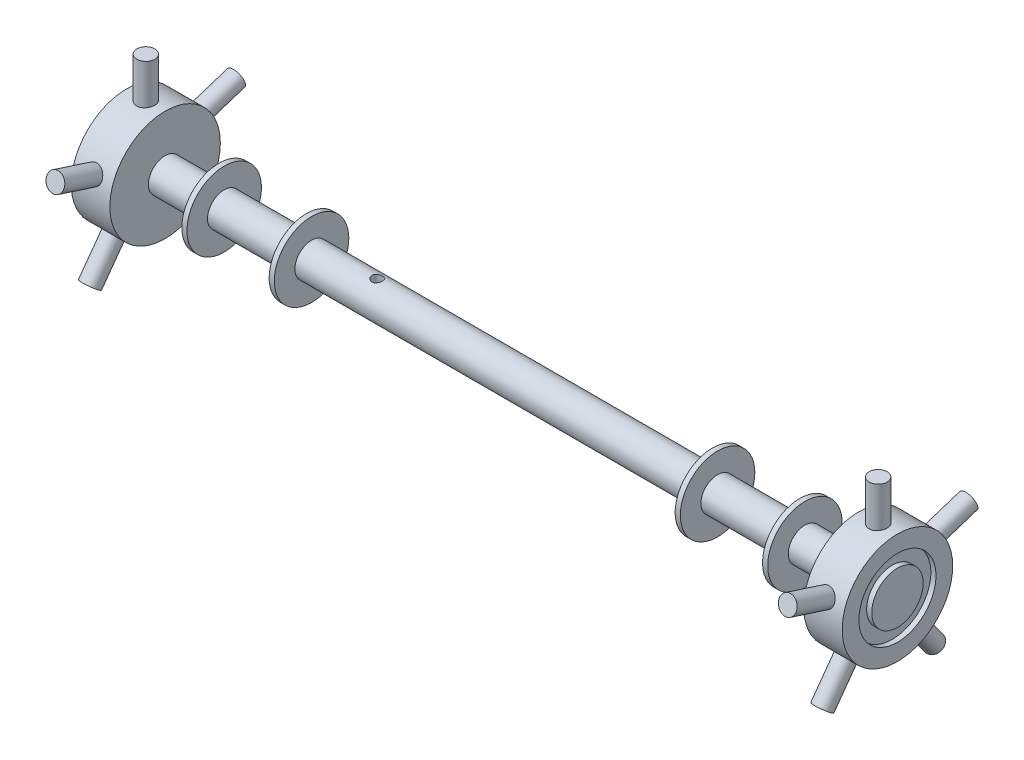
from build123d import *

# Parameters (mm, degrees)
SKETCH2_R               = 8.255
BOSS_EXTRUDE1_DEPTH     = 190.5
SKETCH3_W               = 19.05
SKETCH3_H               = 19.05
SKETCH3_W_2             = 2.54
SKETCH3_H_2             = 10.16
SKETCH6_R               = 19.05
SKETCH6_R_2             = 12.7
CUT_EXTRUDE1_DEPTH      = 2.54
SKETCH5_R               = 4.445
BOSS_EXTRUDE3_DEPTH     = 25.4
CIRPATTERN2_COUNT       = 5
MIRROR3_COPY_1_SKETCH_R = 4.445
MIRROR3_COPY_1_DEPTH    = 25.4
MIRROR3_COPY_2_SKETCH_R = 4.445
MIRROR3_COPY_2_DEPTH    = 25.4
MIRROR3_COPY_3_SKETCH_R = 4.445
MIRROR3_COPY_3_DEPTH    = 25.4
MIRROR3_COPY_4_SKETCH_R = 4.445
MIRROR3_COPY_4_DEPTH    = 25.4
SKETCH7_R               = 2.54
CUT_EXTRUDE2_DEPTH      = 206.628908418


with BuildPart() as part:
    # Sketch2 → Boss-Extrude1 (new, symmetric)
    with BuildSketch(Plane(origin=(0, 0, 0), x_dir=(0, 0, -1), z_dir=(1, 0, 0))):
        Circle(SKETCH2_R)
    extrude(amount=BOSS_EXTRUDE1_DEPTH, both=True)

    # Sketch3 → Revolve1 (revolve)
    with BuildSketch(Plane.XY, mode=Mode.PRIVATE) as revolve1_sk:
        with Locations((180.975, 17.78)):
            Rectangle(SKETCH3_W, SKETCH3_H)
        with Locations((100.33, 13.335)):
            Rectangle(SKETCH3_W_2, SKETCH3_H_2)
        with Locations((143.51, 13.335)):
            Rectangle(SKETCH3_W_2, SKETCH3_H_2)
        with Locations((-100.33, 13.335)):
            Rectangle(SKETCH3_W_2, SKETCH3_H_2)
        with Locations((-143.51, 13.335)):
            Rectangle(SKETCH3_W_2, SKETCH3_H_2)
        with Locations((-180.975, 17.78)):
            Rectangle(SKETCH3_W, SKETCH3_H)
    revolve(revolve1_sk.sketch.rotate(Axis((190.5, 0, 0), (-1, 0, 0)), 90), axis=Axis((190.5, 0, 0), (-1, 0, 0)))

    # Sketch6 → Cut-Extrude1 (cut)
    with BuildSketch(Plane.ZY.offset(190.5)):
        Circle(SKETCH6_R)
        Circle(SKETCH6_R_2, mode=Mode.SUBTRACT)
    cut_extrude1 = extrude(amount=-CUT_EXTRUDE1_DEPTH, mode=Mode.SUBTRACT)

    # Mirror2: Cut-Extrude1 across plane
    add(cut_extrude1.mirror(Plane(origin=(0, 0, 0), x_dir=(0, 0, 1), z_dir=(1, 0, 0))), mode=Mode.SUBTRACT)

    # Sketch5 → Boss-Extrude3 (add)
    with BuildSketch(Plane(origin=(0, 21.59, 0), x_dir=(1, 0, 0), z_dir=(0, 1, 0))):
        with Locations(Location((-180.975, 0, 0), (0, 0, 90))):
            Circle(SKETCH5_R)
    boss_extrude3 = extrude(amount=BOSS_EXTRUDE3_DEPTH)

    # CirPattern2: Boss-Extrude3 ×5 about axis
    cirpattern2_axis = Axis((0, 0, 0), (1, 0, 0))
    for i in range(1, CIRPATTERN2_COUNT):
        add(boss_extrude3.rotate(cirpattern2_axis, i * 360 / CIRPATTERN2_COUNT))

    # Mirror3: Boss-Extrude3 across plane
    add(boss_extrude3.mirror(Plane(origin=(0, 0, 0), x_dir=(0, 0, 1), z_dir=(1, 0, 0))))

    # Mirror3 copy 1 sketch → Mirror3 copy 1 (add)
    with BuildSketch(Plane(origin=(0, 6.671676909, 20.533310187), x_dir=(-1, 0, 0), z_dir=(0, 0.30901699437494745, 0.9510565162951535))):
        with Locations((-180.975, 0)):
            Circle(MIRROR3_COPY_1_SKETCH_R)
    extrude(amount=MIRROR3_COPY_1_DEPTH)

    # Mirror3 copy 2 sketch → Mirror3 copy 2 (add)
    with BuildSketch(Plane(origin=(0, -17.466676909, 12.690283597), x_dir=(-1, 0, 0), z_dir=(0, -0.8090169943749473, 0.5877852522924732))):
        with Locations((-180.975, 0)):
            Circle(MIRROR3_COPY_2_SKETCH_R)
    extrude(amount=MIRROR3_COPY_2_DEPTH)

    # Mirror3 copy 3 sketch → Mirror3 copy 3 (add)
    with BuildSketch(Plane(origin=(0, -17.466676909, -12.690283597), x_dir=(-1, 0, 0), z_dir=(0, -0.8090169943749476, -0.587785252292473))):
        with Locations((-180.975, 0)):
            Circle(MIRROR3_COPY_3_SKETCH_R)
    extrude(amount=MIRROR3_COPY_3_DEPTH)

    # Mirror3 copy 4 sketch → Mirror3 copy 4 (add)
    with BuildSketch(Plane(origin=(0, 6.671676909, -20.533310187), x_dir=(-1, 0, 0), z_dir=(0, 0.30901699437494723, -0.9510565162951536))):
        with Locations((-180.975, 0)):
            Circle(MIRROR3_COPY_4_SKETCH_R)
    extrude(amount=MIRROR3_COPY_4_DEPTH)

    # Sketch7 → Cut-Extrude2 (cut, through all)
    with BuildSketch(Plane(origin=(0, 21.59, 0), x_dir=(1, 0, 0), z_dir=(0, 1, 0))):
        with Locations(Location((-66.606224815, 0, 0), (0, 0, 270))):
            Circle(SKETCH7_R)
    extrude(amount=-CUT_EXTRUDE2_DEPTH, mode=Mode.SUBTRACT)


solid = part.part
